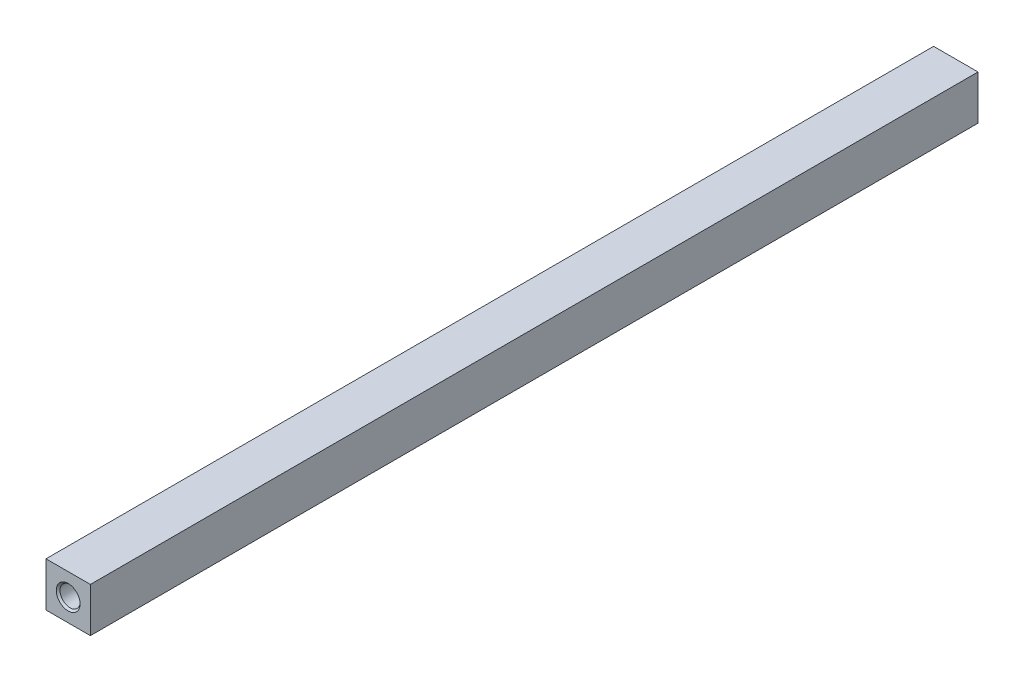
from build123d import *

# Parameters (mm, degrees)
SKETCH1_W           = 15
SKETCH1_H           = 15
BOSS_EXTRUDE1_DEPTH = 150


with BuildPart() as part:
    # Sketch1 → Boss-Extrude1 (new, symmetric)
    with BuildSketch(Plane.XY):
        Rectangle(SKETCH1_W, SKETCH1_H)
    extrude(amount=BOSS_EXTRUDE1_DEPTH, both=True)

    # Sketch3 → M8 Tapped Hole1 (revolve, cut)
    with BuildSketch(Plane(origin=(0, 0, 150), x_dir=(0, -1, 0), z_dir=(1, 0, 0))):
        Polygon((0, 0), (0, 24.292926105), (3.4, 22.25), (3.4, 0.625), (4.025, 0), align=None)
    m8_tapped_hole1 = revolve(axis=Axis((0, 0, 156.35), (0, 0, -1)), mode=Mode.SUBTRACT)

    # Mirror1: M8 Tapped Hole1 across plane
    add(m8_tapped_hole1.mirror(Plane.XY), mode=Mode.SUBTRACT)


solid = part.part
